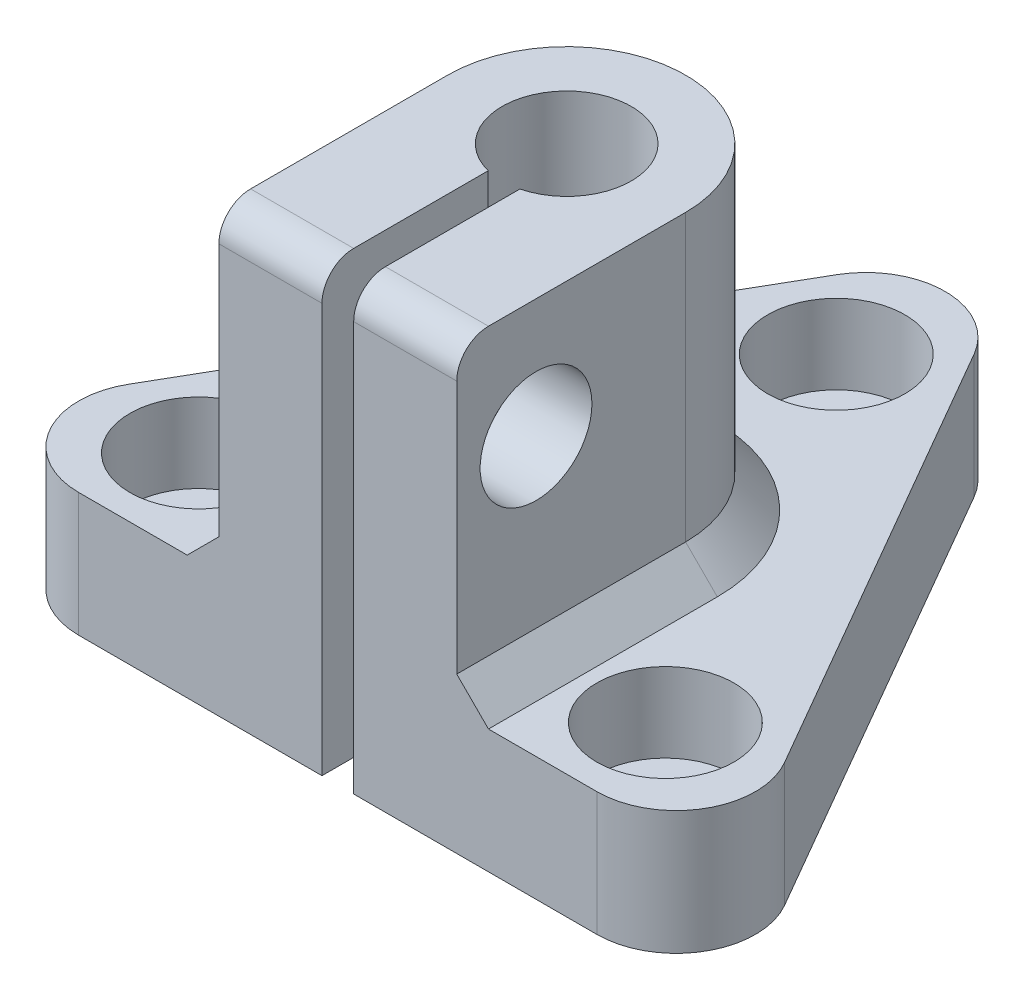
from build123d import *

# Parameters (mm, degrees)
ESQUISSE5_R              = 2.6
BOSS_EXTRU_2_DEPTH       = 7.8
ESQUISSE6_R              = 7.5
BOSS_EXTRU_3_DEPTH       = 20
BOSS_EXTRU_6_START       = -20
BOSS_EXTRU_6_DEPTH       = 20
ESQUISSE14_R             = 4.075
ENL_V_MAT_EXTRU_4_DEPTH  = 48.235297536
ENL_V_MAT_EXTRU_5_DEPTH  = 48.235297536
CONG_2_R                 = 5
ESQUISSE17_R             = 2.075
ENL_V_MAT_EXTRU_6_DEPTH  = 47.62863011
ENL_V_MAT_EXTRU_7_DEPTH  = 3.25
ESQUISSE19_R             = 4.325
ENL_V_MAT_EXTRU_8_DEPTH  = 5
ESQUISSE20_R             = 3.525
ENL_V_MAT_EXTRU_9_DEPTH  = 4.97
CONG_3_R                 = 2
CHANFREIN2_SIZE          = 2
ENL_V_MAT_EXTRU_10_DEPTH = 44.729429119


with BuildPart() as part:
    # Esquisse5 → Boss.-Extru.2 (new body)
    with BuildSketch(Plane(origin=(0, 0, 0), x_dir=(1, 0, 0), z_dir=(0, 1, 0))):
        Polygon((-25, -14.43375673), (25, -14.43375673), (0, 28.867513459), align=None)
        with Locations(Location((0, 17, 0), (0, 0, 270))):
            Circle(ESQUISSE5_R, mode=Mode.SUBTRACT)
        with Locations(Location((-14.722431864, -8.5, 0), (0, 0, 270))):
            Circle(ESQUISSE5_R, mode=Mode.SUBTRACT)
        with Locations(Location((14.722431864, -8.5, 0), (0, 0, 270))):
            Circle(ESQUISSE5_R, mode=Mode.SUBTRACT)
    extrude(amount=BOSS_EXTRU_2_DEPTH)

    # Esquisse6 → Boss.-Extru.3 (add)
    with BuildSketch(Plane(origin=(0, 7.8, 0), x_dir=(1, 0, 0), z_dir=(0, 1, 0))):
        with Locations(Location((0, 0, 0), (0, 0, 270))):
            Circle(ESQUISSE6_R)
    extrude(amount=BOSS_EXTRU_3_DEPTH)

    # Esquisse13 → Boss.-Extru.6 (add)
    with BuildSketch(Plane(origin=(0, 27.8, 0), x_dir=(1, 0, 0), z_dir=(0, 1, 0)).offset(BOSS_EXTRU_6_START)):
        with BuildLine():
            Line((-7.5, 0), (-7.5, -14.43375673))
            Line((-7.5, -14.43375673), (7.5, -14.43375673))
            Line((7.5, -14.43375673), (7.5, 0))
            ThreePointArc((7.5, 0), (0, -7.5), (-7.5, 0))
        make_face()
    extrude(amount=BOSS_EXTRU_6_DEPTH)

    # Esquisse14 → Enlèv. mat.-Extru.4 (cut, through all)
    with BuildSketch(Plane(origin=(0, 27.8, 0), x_dir=(1, 0, 0), z_dir=(0, 1, 0))):
        with Locations(Location((0, 0, 0), (0, 0, 270))):
            Circle(ESQUISSE14_R)
    extrude(amount=-ENL_V_MAT_EXTRU_4_DEPTH, mode=Mode.SUBTRACT)

    # Esquisse15 → Enlèv. mat.-Extru.5 (cut, through all)
    with BuildSketch(Plane(origin=(0, 27.8, 0), x_dir=(1, 0, 0), z_dir=(0, 1, 0))):
        with BuildLine():
            Line((-1, -3.95039555), (-1, -14.43375673))
            Line((-1, -14.43375673), (1, -14.43375673))
            Line((1, -14.43375673), (1, -3.95039555))
            ThreePointArc((1, -3.95039555), (0, -4.075), (-1, -3.95039555))
        make_face()
    extrude(amount=-ENL_V_MAT_EXTRU_5_DEPTH, mode=Mode.SUBTRACT)

    # Congé2
    cong_2_edges = [part.edges().sort_by_distance(p)[0] for p in [
        (0, 3.9, -28.867513459),
        (25, 3.9, 14.43375673),
        (-25, 3.9, 14.43375673),
    ]]
    fillet(cong_2_edges, radius=CONG_2_R)

    # Esquisse17 → Enlèv. mat.-Extru.6 (cut, through all)
    with BuildSketch(Plane(origin=(7.5, 0, 0), x_dir=(0, 0, -1), z_dir=(1, 0, 0))):
        with Locations((-9.43375673, 20.3)):
            Circle(ESQUISSE17_R)
    extrude(amount=-ENL_V_MAT_EXTRU_6_DEPTH, mode=Mode.SUBTRACT)

    # Esquisse18 → Enlèv. mat.-Extru.7 (cut)
    with BuildSketch(Plane.ZY.offset(7.5)):
        Polygon((11.468916429, 23.825), (7.398597031, 23.825), (5.363437332, 20.3), (7.398597031, 16.775), (11.468916429, 16.775), (13.504076128, 20.3), align=None)
    extrude(amount=-ENL_V_MAT_EXTRU_7_DEPTH, mode=Mode.SUBTRACT)

    # Esquisse19 → Enlèv. mat.-Extru.8 (cut)
    with BuildSketch(Plane(origin=(0, 7.8, 0), x_dir=(1, 0, 0), z_dir=(0, 1, 0))):
        with Locations(Location((0, 17, 0), (0, 0, 270))):
            Circle(ESQUISSE19_R)
        with Locations(Location((14.722431864, -8.5, 0), (0, 0, 270))):
            Circle(ESQUISSE19_R)
        with Locations(Location((-14.722431864, -8.5, 0), (0, 0, 270))):
            Circle(ESQUISSE19_R)
    extrude(amount=-ENL_V_MAT_EXTRU_8_DEPTH, mode=Mode.SUBTRACT)

    # Esquisse20 → Enlèv. mat.-Extru.9 (cut)
    with BuildSketch(Plane(origin=(7.5, 0, 0), x_dir=(0, 0, -1), z_dir=(1, 0, 0))):
        with Locations((-9.43375673, 20.3)):
            Circle(ESQUISSE20_R)
    extrude(amount=-ENL_V_MAT_EXTRU_9_DEPTH, mode=Mode.SUBTRACT)

    # Congé3
    cong_3_edges = [part.edges().sort_by_distance(p)[0] for p in [
        (-4.25, 27.8, 14.43375673),
        (4.25, 27.8, 14.43375673),
    ]]
    fillet(cong_3_edges, radius=CONG_3_R)

    # Chanfrein2
    chanfrein2_edges = [part.edges().sort_by_distance(p)[0] for p in [
        (0, 7.8, -7.5),
        (7.5, 7.8, 7.216878365),
        (-7.5, 7.8, 7.216878365),
    ]]
    chamfer(chanfrein2_edges, length=CHANFREIN2_SIZE)

    # Esquisse21 → Enlèv. mat.-Extru.10 (cut, through all)
    with BuildSketch(Plane(origin=(2.53, 0, 0), x_dir=(0, 0, -1), z_dir=(1, 0, 0))):
        Polygon((-10.392924593, 22.140005981), (-8.474588866, 22.140005981), (-9.43375673, 22.640005981), align=None)
    extrude(amount=-ENL_V_MAT_EXTRU_10_DEPTH, mode=Mode.SUBTRACT)


solid = part.part
